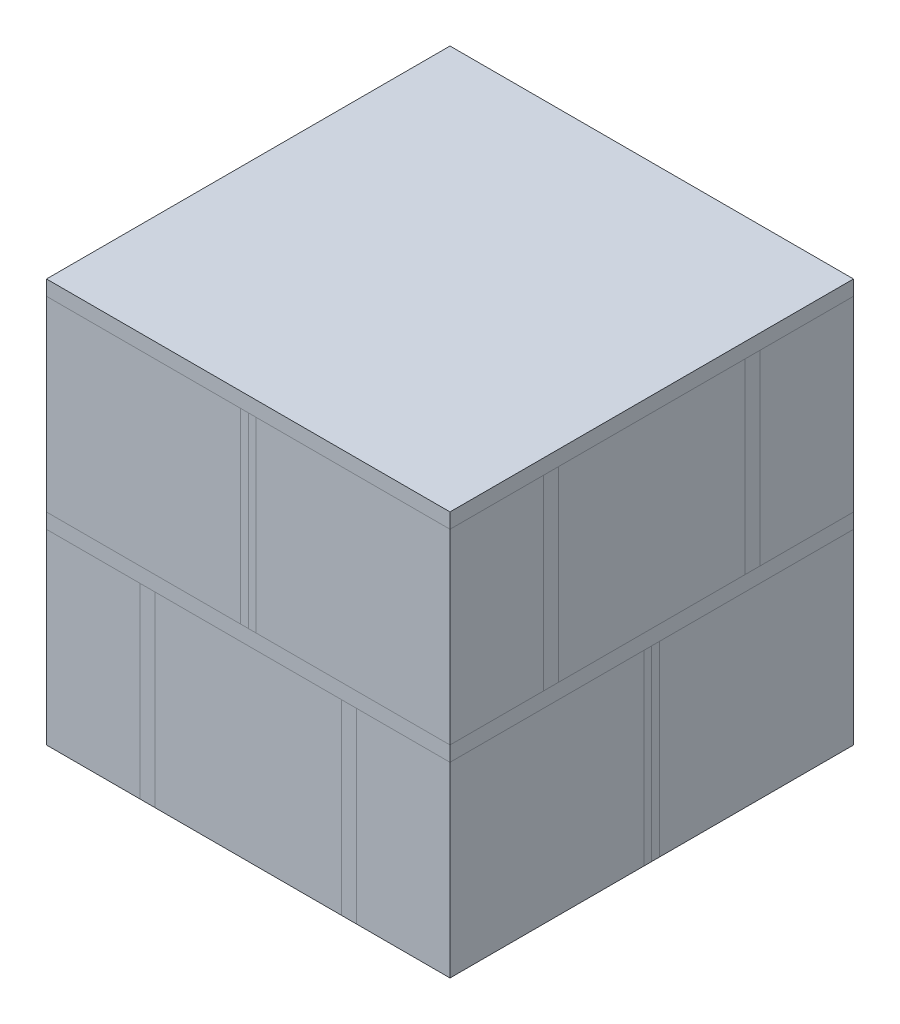
from build123d import *

# Parameters (mm, degrees)
SKETCH_3_W             = 6.215
SKETCH_3_H             = 12.935
EXTRUDE_2_DEPTH        = 12.44
SKETCH_3_W_2           = 12.44
EXTRUDE_2_2_DEPTH      = 12.44
EXTRUDE_2_3_DEPTH      = 12.44
EXTRUDE_3_DEPTH        = 12.44
SKETCH_4_W             = 26.87
SKETCH_4_H             = 26.87
EXTRUDE_4_DEPTH        = 1
SKETCH_6_W             = 12.935
SKETCH_6_H             = 6.215
EXTRUDE_5_DEPTH        = 12.44
SKETCH_6_H_2           = 12.44
EXTRUDE_5_2_DEPTH      = 12.44
EXTRUDE_5_3_DEPTH      = 12.44
EXTRUDE_6_DEPTH        = 12.44
PATTERN_LINEAR_2_COUNT = 2
PATTERN_LINEAR_2_PITCH = 13.44


with BuildPart() as part:
    # Эскиз3 → Бобышка-Вытянуть2 (new body)
    with BuildSketch(Plane(origin=(0, 0, 0), x_dir=(1, 0, 0), z_dir=(0, 1, 0))):
        with Locations((-10.3275, -6.9675)):
            Rectangle(SKETCH_3_W, SKETCH_3_H)
    extrude(amount=EXTRUDE_2_DEPTH)


with BuildPart() as body_2:
    # Эскиз3 → Extrude 2 2 (new body)
    with BuildSketch(Plane(origin=(0, 0, 0), x_dir=(1, 0, 0), z_dir=(0, 1, 0))):
        with Locations((0, -6.9675)):
            Rectangle(SKETCH_3_W_2, SKETCH_3_H)
    extrude(amount=EXTRUDE_2_2_DEPTH)


with BuildPart() as body_3:
    # Эскиз3 → Extrude 2 3 (new body)
    with BuildSketch(Plane(origin=(0, 0, 0), x_dir=(1, 0, 0), z_dir=(0, 1, 0))):
        with Locations((10.3275, -6.9675)):
            Rectangle(SKETCH_3_W, SKETCH_3_H)
    extrude(amount=EXTRUDE_2_3_DEPTH)


with BuildPart() as body_4:
    # Эскиз3<4> → Бобышка-Вытянуть3 (new body)
    with BuildSketch(Plane(origin=(0, 0, 0), x_dir=(1, 0, 0), z_dir=(0, 1, 0))):
        Polygon((-6.22, -0.5), (6.22, -0.5), (6.22, -13.435), (6.72, -13.435), (6.72, 0), (-6.72, 0), (-6.72, -13.435), (-6.22, -13.435), align=None)
        Polygon((6.72, 0), (6.72, -13.435), (7.22, -13.435), (7.22, -0.5), (13.435, -0.5), (13.435, 0), align=None)
        Polygon((-7.22, -13.435), (-6.72, -13.435), (-6.72, 0), (-13.435, 0), (-13.435, -0.5), (-7.22, -0.5), align=None)
    extrude(amount=EXTRUDE_3_DEPTH)


with BuildPart() as body_5:
    # Зеркальное отражение1: mirrored copy
    add(body_4.part.mirror(Plane.XY))


with BuildPart() as body_6:
    # Mirror 1 2: mirrored copy
    add(body_3.part.mirror(Plane.XY))


with BuildPart() as body_7:
    # Mirror 1 3: mirrored copy
    add(part.part.mirror(Plane.XY))


with BuildPart() as body_8:
    # Mirror 1 4: mirrored copy
    add(body_2.part.mirror(Plane.XY))


with BuildPart() as body_9:
    # Эскиз4 → Бобышка-Вытянуть4 (new body)
    with BuildSketch(Plane(origin=(0, 12.44, 0), x_dir=(1, 0, 0), z_dir=(0, 1, 0))):
        Rectangle(SKETCH_4_W, SKETCH_4_H)
    extrude_4 = extrude(amount=EXTRUDE_4_DEPTH)


with BuildPart() as body_10:
    # Эскиз6 → Бобышка-Вытянуть5 (new body)
    with BuildSketch(Plane(origin=(0, 13.44, 0), x_dir=(1, 0, 0), z_dir=(0, 1, 0))):
        with Locations((6.9675, -10.3275)):
            Rectangle(SKETCH_6_W, SKETCH_6_H)
    extrude(amount=EXTRUDE_5_DEPTH)


with BuildPart() as body_11:
    # Эскиз6 → Extrude 5 2 (new body)
    with BuildSketch(Plane(origin=(0, 13.44, 0), x_dir=(1, 0, 0), z_dir=(0, 1, 0))):
        with Locations((6.9675, 0)):
            Rectangle(SKETCH_6_W, SKETCH_6_H_2)
    extrude(amount=EXTRUDE_5_2_DEPTH)


with BuildPart() as body_12:
    # Эскиз6 → Extrude 5 3 (new body)
    with BuildSketch(Plane(origin=(0, 13.44, 0), x_dir=(1, 0, 0), z_dir=(0, 1, 0))):
        with Locations((6.9675, 10.3275)):
            Rectangle(SKETCH_6_W, SKETCH_6_H)
    extrude(amount=EXTRUDE_5_3_DEPTH)


with BuildPart() as body_13:
    # Эскиз6<6> → Бобышка-Вытянуть6 (new body)
    with BuildSketch(Plane(origin=(0, 13.44, 0), x_dir=(1, 0, 0), z_dir=(0, 1, 0))):
        Polygon((13.435, -7.22), (13.435, -6.72), (0, -6.72), (0, -13.435), (0.5, -13.435), (0.5, -7.22), align=None)
        Polygon((0.5, -6.22), (0.5, 6.22), (13.435, 6.22), (13.435, 6.72), (0, 6.72), (0, -6.72), (13.435, -6.72), (13.435, -6.22), align=None)
        Polygon((0, 6.72), (13.435, 6.72), (13.435, 7.22), (0.5, 7.22), (0.5, 13.435), (0, 13.435), align=None)
    extrude(amount=EXTRUDE_6_DEPTH)


with BuildPart() as body_14:
    # Зеркальное отражение2: mirrored copy
    add(body_10.part.mirror(Plane(origin=(0, 0, 0), x_dir=(0, 0, 1), z_dir=(1, 0, 0))))


with BuildPart() as body_15:
    # Mirror 2 2: mirrored copy
    add(body_11.part.mirror(Plane(origin=(0, 0, 0), x_dir=(0, 0, 1), z_dir=(1, 0, 0))))


with BuildPart() as body_16:
    # Mirror 2 3: mirrored copy
    add(body_12.part.mirror(Plane(origin=(0, 0, 0), x_dir=(0, 0, 1), z_dir=(1, 0, 0))))


with BuildPart() as body_17:
    # Mirror 2 4: mirrored copy
    add(body_13.part.mirror(Plane(origin=(0, 0, 0), x_dir=(0, 0, 1), z_dir=(1, 0, 0))))


with BuildPart() as pattern_linear_2_1:
    # Линейный массив2: Бобышка-Вытянуть4 ×2
    with Locations(*[(0, i * PATTERN_LINEAR_2_PITCH, 0) for i in range(1, PATTERN_LINEAR_2_COUNT)]):
        add(extrude_4)


solid = Compound([part.part, body_2.part, body_3.part, body_4.part, body_5.part, body_6.part, body_7.part, body_8.part, body_9.part, body_10.part, body_11.part, body_12.part, body_13.part, body_14.part, body_15.part, body_16.part, body_17.part, pattern_linear_2_1.part])
